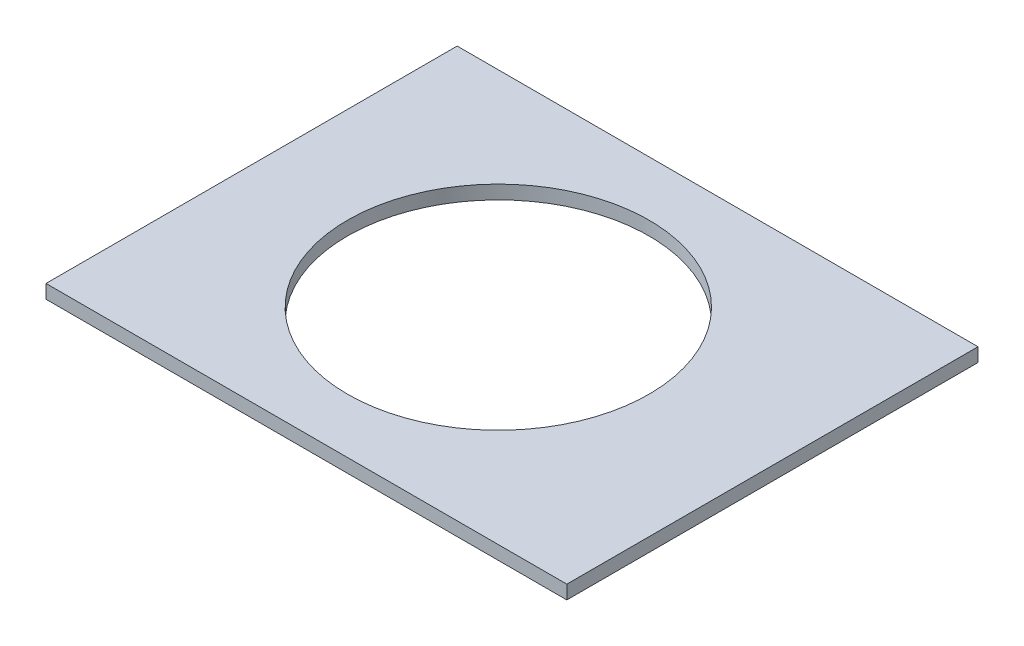
from build123d import *

# Parameters (mm, degrees)
SKETCH_1_W          = 38
SKETCH_1_H          = 30
EXTRUDE_1_DEPTH     = 8
CUT_EXTRUDE_START   = 1
SKETCH_2_W          = 37
SKETCH_2_H          = 28
CUT_EXTRUDE_1_DEPTH = 7
EXTRUDE_START       = 8
SKETCH_4_W          = 38
SKETCH_4_H          = 30
EXTRUDE_3_DEPTH     = 1
CUT_EXTRUDE_START_2 = 9
SKETCH_5_R          = 11
CUT_EXTRUDE_2_DEPTH = 1
SKETCH_7_W          = 38
SKETCH_7_H          = 30
CUT_EXTRUDE_4_DEPTH = 8


with BuildPart() as part:
    # 스케치1 → 보스-돌출1 (new body)
    with BuildSketch(Plane(origin=(0, 0, 0), x_dir=(1, 0, 0), z_dir=(0, 1, 0))):
        Rectangle(SKETCH_1_W, SKETCH_1_H)
    extrude(amount=EXTRUDE_1_DEPTH)

    # 스케치2 → 컷-돌출1 (cut)
    with BuildSketch(Plane(origin=(0, 0, 0), x_dir=(1, 0, 0), z_dir=(0, 1, 0)).offset(CUT_EXTRUDE_START)):
        with Locations((0.5, 0)):
            Rectangle(SKETCH_2_W, SKETCH_2_H)
    extrude(amount=CUT_EXTRUDE_1_DEPTH, mode=Mode.SUBTRACT)

    # 스케치7 → 컷-돌출4 (cut)
    with BuildSketch(Plane.XZ):
        Rectangle(SKETCH_7_W, SKETCH_7_H)
    extrude(amount=-CUT_EXTRUDE_4_DEPTH, mode=Mode.SUBTRACT)


with BuildPart() as body_2:
    # 스케치4 → 보스-돌출3 (new body)
    with BuildSketch(Plane(origin=(0, 0, 0), x_dir=(1, 0, 0), z_dir=(0, 1, 0)).offset(EXTRUDE_START)):
        Rectangle(SKETCH_4_W, SKETCH_4_H)
    extrude(amount=EXTRUDE_3_DEPTH)

    # 스케치5 → 컷-돌출2 (cut)
    with BuildSketch(Plane(origin=(0, 0, 0), x_dir=(1, 0, 0), z_dir=(0, 1, 0)).offset(CUT_EXTRUDE_START_2)):
        with Locations(Location((-1, 0, 0), (0, 0, 270))):
            Circle(SKETCH_5_R)
    extrude(amount=-CUT_EXTRUDE_2_DEPTH, mode=Mode.SUBTRACT)


solid = body_2.part
